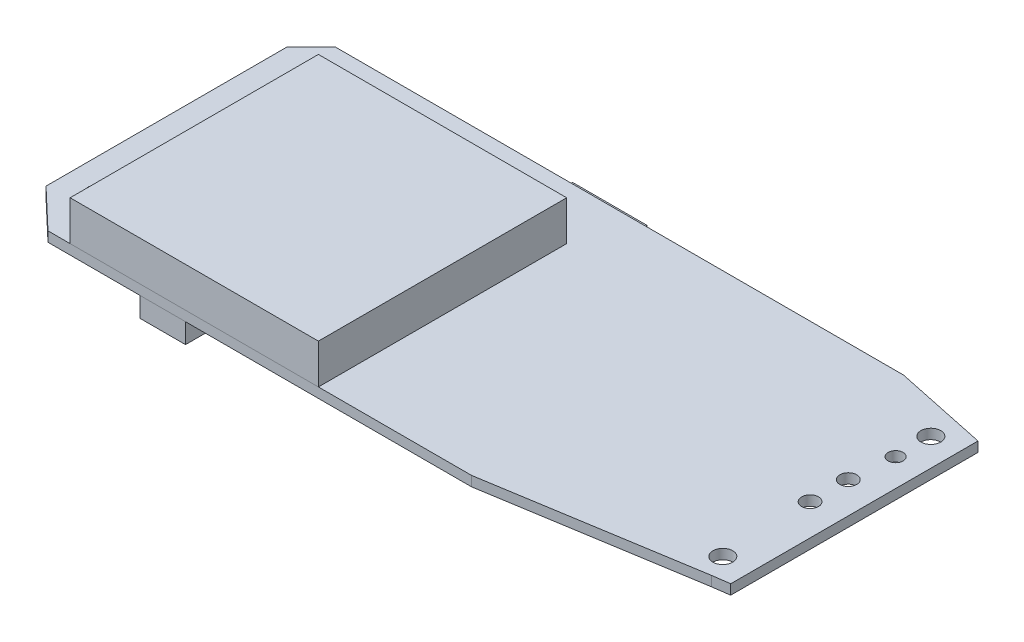
from build123d import *

# Parameters (mm, degrees)
SKETCH1_R           = 1
SKETCH1_R_2         = 0.85
SKETCH1_R_3         = 0.75
BOSS_EXTRUDE1_DEPTH = 1
SKETCH2_W           = 25
SKETCH2_H           = 25
BOSS_EXTRUDE2_DEPTH = 4
SKETCH3_W           = 15.85
SKETCH3_H           = 16.4
BOSS_EXTRUDE3_DEPTH = 1.5
SKETCH4_W           = 7.5
SKETCH4_H           = 5.3
BOSS_EXTRUDE4_DEPTH = 2.5
SKETCH5_W           = 4.56
SKETCH5_H           = 2.4
BOSS_EXTRUDE5_DEPTH = 2


with BuildPart() as part:
    # Sketch1 → Boss-Extrude1 (new body)
    with BuildSketch(Plane(origin=(0, 0, 0), x_dir=(1, 0, 0), z_dir=(0, 1, 0))):
        Polygon((-32.175, 15.25), (25.075, 15.25), (34.575, 13.25), (34.575, -11.65), (32.875, -11.89), (12.075, -15.25), (-30.575, -15.25), (-34.575, -11.45), (-34.575, 12.85), align=None)
        with Locations(Location((31.795, 11.280462126, 0), (0, 0, 270))):
            Circle(SKETCH1_R, mode=Mode.SUBTRACT)
        with Locations(Location((31.795, -9.669537874, 0), (0, 0, 270))):
            Circle(SKETCH1_R, mode=Mode.SUBTRACT)
        with Locations(Location((31.415, -0.499537874, 0), (0, 0, 270))):
            Circle(SKETCH1_R_2, mode=Mode.SUBTRACT)
        with Locations(Location((31.415, 3.350462126, 0), (0, 0, 270))):
            Circle(SKETCH1_R_2, mode=Mode.SUBTRACT)
        with Locations(Location((31.795, 7.730462126, 0), (0, 0, 270))):
            Circle(SKETCH1_R_3, mode=Mode.SUBTRACT)
        with Locations(Location((-31.375, -9.43, 0), (0, 0, 270))):
            Circle(SKETCH1_R, mode=Mode.SUBTRACT)
        with Locations(Location((-31.375, -5.91, 0), (0, 0, 270))):
            Circle(SKETCH1_R_3, mode=Mode.SUBTRACT)
    extrude(amount=BOSS_EXTRUDE1_DEPTH)


with BuildPart() as body_2:
    # Sketch2 → Boss-Extrude2 (new body)
    with BuildSketch(Plane(origin=(0, 1, 0), x_dir=(1, 0, 0), z_dir=(0, 1, 0))):
        with Locations((-15.845, -2.75)):
            Rectangle(SKETCH2_W, SKETCH2_H)
    extrude(amount=BOSS_EXTRUDE2_DEPTH)


with BuildPart() as body_3:
    # Sketch3 → Boss-Extrude3 (new body)
    with BuildSketch(Plane(origin=(0, 0, 0), x_dir=(-1, 0, 0), z_dir=(0, -1, 0))):
        with Locations((19.47, 7.05)):
            Rectangle(SKETCH3_W, SKETCH3_H)
    extrude(amount=BOSS_EXTRUDE3_DEPTH)


with BuildPart() as body_4:
    # Sketch4 → Boss-Extrude4 (new body)
    with BuildSketch(Plane.XZ):
        with Locations((-5.625, -13.74)):
            Rectangle(SKETCH4_W, SKETCH4_H)
    extrude(amount=BOSS_EXTRUDE4_DEPTH)


with BuildPart() as body_5:
    # Sketch5 → Boss-Extrude5 (new body)
    with BuildSketch(Plane.XZ):
        with Locations((-19.005, 14.05)):
            Rectangle(SKETCH5_W, SKETCH5_H)
    extrude(amount=BOSS_EXTRUDE5_DEPTH)


solid = Compound([part.part, body_2.part, body_3.part, body_4.part, body_5.part])
